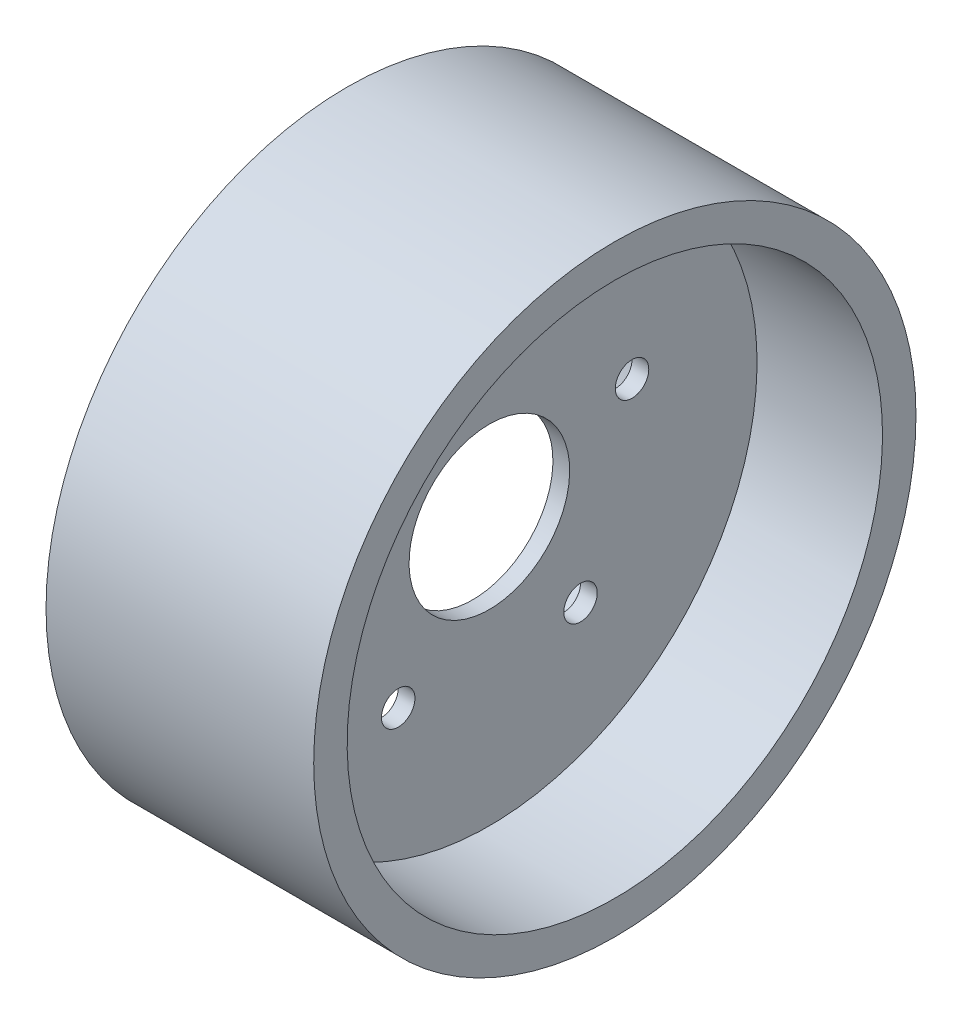
from build123d import *

# Parameters (mm, degrees)
SKETCH1_W                  = 6.35
SKETCH1_H                  = 101.6
SKETCH2_R                  = 30.48
CUT_EXTRUDE2_DEPTH         = 171.417958634
F_1_2_0_5_DIAMETER_HOLE2_D = 12.7


with BuildPart() as part:
    # Sketch1 → Revolve1 (revolve)
    with BuildSketch(Plane.XY):
        with Locations((3.175, 50.8)):
            Rectangle(SKETCH1_W, SKETCH1_H)
        Polygon((-47.625, 101.6), (0, 101.6), (6.35, 101.6), (53.975, 101.6), (53.975, 114.3), (-47.625, 114.3), align=None)
    revolve(axis=Axis((6.35, 0, 0), (-1, 0, 0)))

    # Sketch2 → Cut-Extrude2 (cut, through all)
    with BuildSketch(Plane(origin=(6.35, 0, 0), x_dir=(0, 0, -1), z_dir=(1, 0, 0))):
        with Locations(Location((0, 0, 0), (0, 0, 90))):
            Circle(SKETCH2_R)
    extrude(amount=-CUT_EXTRUDE2_DEPTH, mode=Mode.SUBTRACT)

    # 1/2 (0.5) Diameter Hole2 (through all)
    with Locations(Plane(origin=(6.35, 0, 0), x_dir=(0, 0, -1), z_dir=(1, 0, 0))):
        with Locations((-54.155626078, 18.25625), (0, 57.15), (54.155626078, 18.25625), (34.599427772, -45.486284722), (-34.599427772, -45.486284722)):
            Hole(F_1_2_0_5_DIAMETER_HOLE2_D / 2)


solid = part.part
